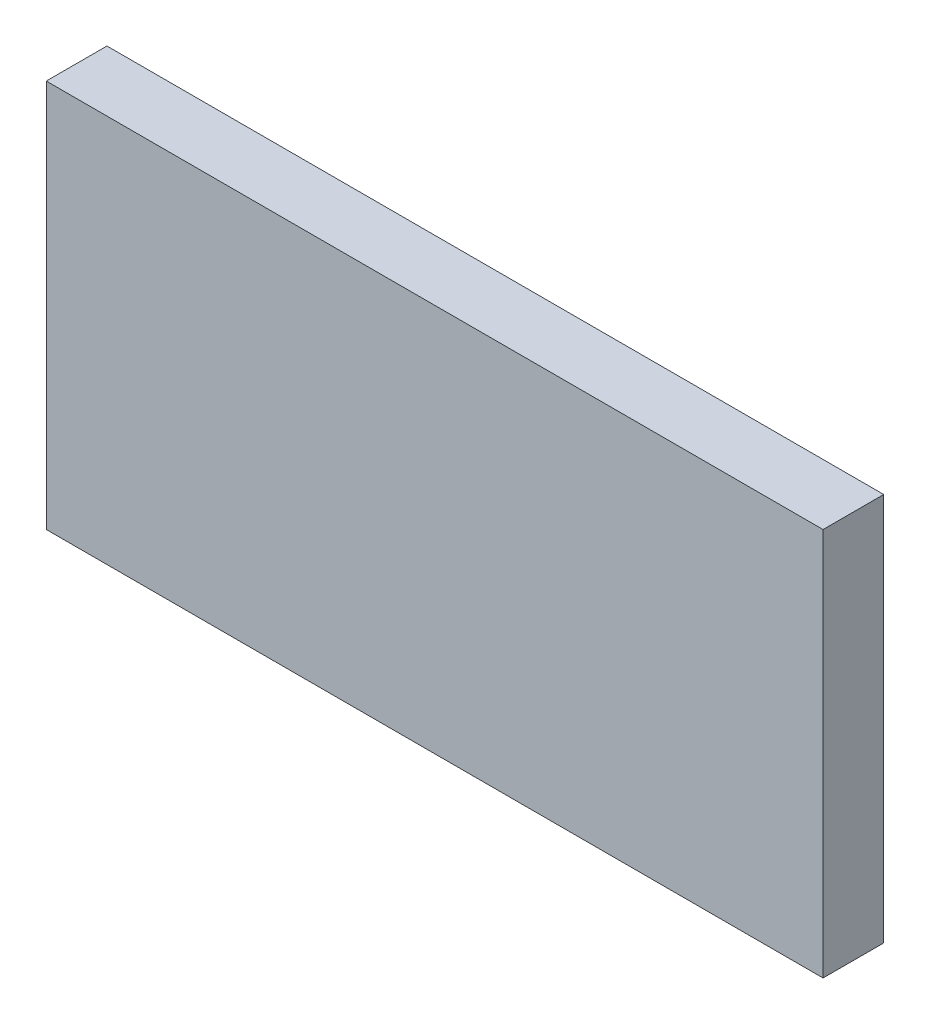
from build123d import *

# Parameters (mm, degrees)
SKETCH1_W           = 64
SKETCH1_H           = 32
BOSS_EXTRUDE1_DEPTH = 5


with BuildPart() as part:
    # Sketch1 → Boss-Extrude1 (new body)
    with BuildSketch(Plane.XY):
        Rectangle(SKETCH1_W, SKETCH1_H)
    extrude(amount=BOSS_EXTRUDE1_DEPTH)


solid = part.part
